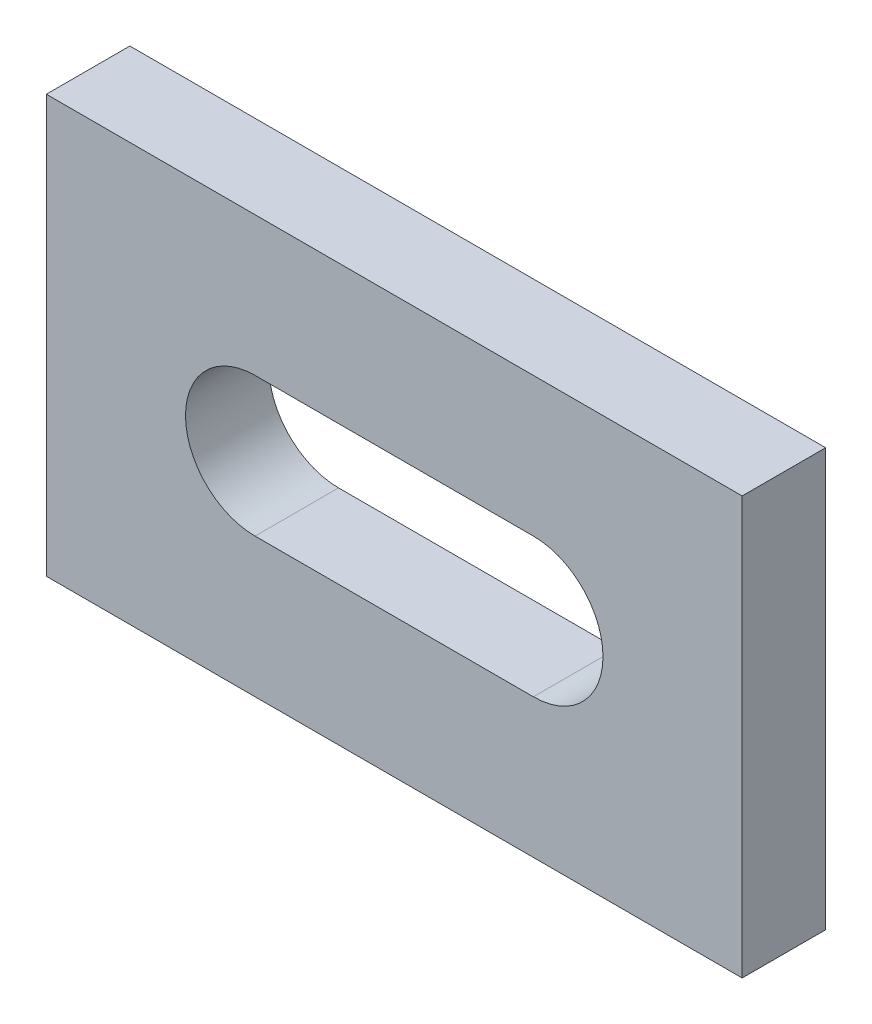
from build123d import *

# Parameters (mm, degrees)
SKETCH1_W           = 150
SKETCH1_H           = 90
BOSS_EXTRUDE1_DEPTH = 18


with BuildPart() as part:
    # Sketch1 → Boss-Extrude1 (new body)
    with BuildSketch(Plane.XY):
        with Locations((75, 45)):
            Rectangle(SKETCH1_W, SKETCH1_H)
        with BuildLine():
            Line((45, 30), (105, 30))
            ThreePointArc((105, 30), (120, 45), (105, 60))
            Line((105, 60), (45, 60))
            ThreePointArc((45, 60), (30, 45), (45, 30))
        make_face(mode=Mode.SUBTRACT)
    extrude(amount=BOSS_EXTRUDE1_DEPTH)


solid = part.part
